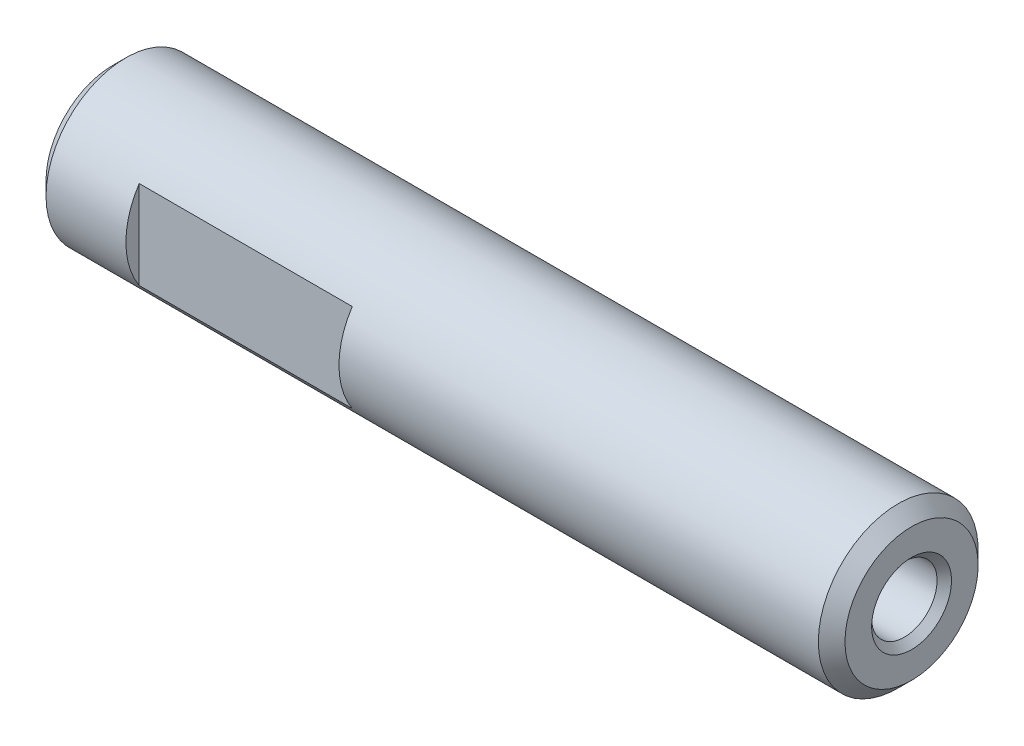
from build123d import *

# Parameters (mm, degrees)
SKETCH4_W          = 10
SKETCH4_H          = 24
SKETCH4_W_2        = 5
SKETCH4_H_2        = 12
CUT_EXTRUDE1_DEPTH = 8


with BuildPart() as part:
    # Sketch1 → Revolve1 (revolve)
    with BuildSketch(Plane.XY, mode=Mode.PRIVATE) as revolve1_sk:
        Polygon((0, 0), (0, 2.5), (0.5, 3), (29.5, 3), (30, 2.5), (30, 0), align=None)
    revolve(revolve1_sk.sketch.rotate(Axis((30, 0, 0), (-1, 0, 0)), 270), axis=Axis((30, 0, 0), (-1, 0, 0)))

    # Sketch2 → Cut-Revolve1 (revolve, cut)
    with BuildSketch(Plane.XY, mode=Mode.PRIVATE) as cut_revolve1_sk:
        Polygon((0, 0), (0, 1.5), (0.2705, 1.2295), (6.490147844, 1.2295), (7.2, 0), align=None)
    revolve(cut_revolve1_sk.sketch.rotate(Axis((7.2, 0, 0), (-1, 0, 0)), 270), axis=Axis((7.2, 0, 0), (-1, 0, 0)), mode=Mode.SUBTRACT)

    # Sketch3 → Cut-Revolve2 (revolve, cut)
    with BuildSketch(Plane.XY, mode=Mode.PRIVATE) as cut_revolve2_sk:
        Polygon((22.8, 0), (23.509852156, 1.2295), (29.7295, 1.2295), (30, 1.5), (30, 0), align=None)
    revolve(cut_revolve2_sk.sketch.rotate(Axis((30, 0, 0), (-1, 0, 0)), 270), axis=Axis((30, 0, 0), (-1, 0, 0)), mode=Mode.SUBTRACT)

    # Sketch4 → Cut-Extrude1 (cut)
    with BuildSketch(Plane(origin=(3.5, 0, 0), x_dir=(0, 0, -1), z_dir=(1, 0, 0))):
        Rectangle(SKETCH4_W, SKETCH4_H)
        Rectangle(SKETCH4_W_2, SKETCH4_H_2, mode=Mode.SUBTRACT)
    extrude(amount=CUT_EXTRUDE1_DEPTH, mode=Mode.SUBTRACT)


solid = part.part
